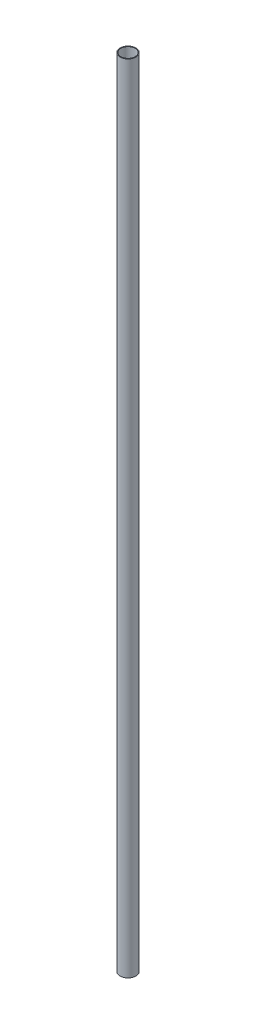
from build123d import *

# Parameters (mm, degrees)
SKETCH_3_R      = 10
SKETCH_3_R_2    = 9
EXTRUDE_1_DEPTH = 1000


with BuildPart() as part:
    # 草图3 → 凸台-拉伸1 (new body)
    with BuildSketch(Plane(origin=(0, 0, 0), x_dir=(1, 0, 0), z_dir=(0, 1, 0))):
        with Locations(Location((0, 0, 0), (0, 0, 270))):
            Circle(SKETCH_3_R)
        with Locations(Location((0, 0, 0), (0, 0, 270))):
            Circle(SKETCH_3_R_2, mode=Mode.SUBTRACT)
    extrude(amount=EXTRUDE_1_DEPTH)


solid = part.part
